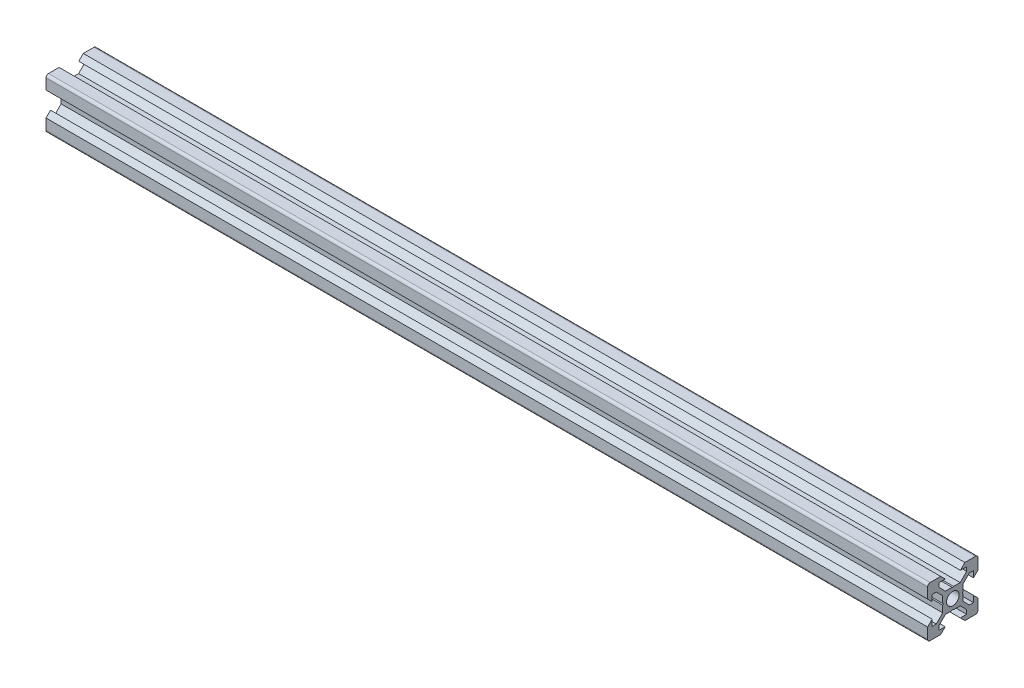
from build123d import *

# Parameters (mm, degrees)
SKETCH11_R                                    = 2.5
C_USERS_USER_GOOGLE_DRIVE_13_INFORMA_ES_DEPTH = 350


with BuildPart() as part:
    # Sketch11 → C_USERS_USER_GOOGLE DRIVE_13. INFORMA_ES (new body)
    with BuildSketch(Plane.YZ):
        with BuildLine():
            Line((-4.8, 10), (-3, 8.2))
            Line((-3, 8.2), (-5.5, 8.2))
            Line((-5.5, 8.2), (-5.5, 6.560660172))
            Line((-5.5, 6.560660172), (-2.939339828, 4))
            Line((-2.939339828, 4), (-0.3, 4))
            Line((-0.3, 4), (0, 3.7))
            Line((0, 3.7), (0.3, 4))
            Line((0.3, 4), (2.939339828, 4))
            Line((2.939339828, 4), (5.5, 6.560660172))
            Line((5.5, 6.560660172), (5.5, 8.2))
            Line((5.5, 8.2), (3, 8.2))
            Line((3, 8.2), (4.8, 10))
            Line((4.8, 10), (9, 10))
            ThreePointArc((9, 10), (9.707106781, 9.707106781), (10, 9))
            Line((10, 9), (10, 4.8))
            Line((10, 4.8), (8.2, 3))
            Line((8.2, 3), (8.2, 5.5))
            Line((8.2, 5.5), (6.560660172, 5.5))
            Line((6.560660172, 5.5), (4, 2.939339828))
            Line((4, 2.939339828), (4, 0.3))
            Line((4, 0.3), (3.7, 0))
            Line((3.7, 0), (4, -0.3))
            Line((4, -0.3), (4, -2.939339828))
            Line((4, -2.939339828), (6.560660172, -5.5))
            Line((6.560660172, -5.5), (8.2, -5.5))
            Line((8.2, -5.5), (8.2, -3))
            Line((8.2, -3), (10, -4.8))
            Line((10, -4.8), (10, -9))
            ThreePointArc((10, -9), (9.707106781, -9.707106781), (9, -10))
            Line((9, -10), (4.8, -10))
            Line((4.8, -10), (3, -8.2))
            Line((3, -8.2), (5.5, -8.2))
            Line((5.5, -8.2), (5.5, -6.560660172))
            Line((5.5, -6.560660172), (2.939339828, -4))
            Line((2.939339828, -4), (0.3, -4))
            Line((0.3, -4), (0, -3.7))
            Line((0, -3.7), (-0.3, -4))
            Line((-0.3, -4), (-2.939339828, -4))
            Line((-2.939339828, -4), (-5.5, -6.560660172))
            Line((-5.5, -6.560660172), (-5.5, -8.2))
            Line((-5.5, -8.2), (-3, -8.2))
            Line((-3, -8.2), (-4.8, -10))
            Line((-4.8, -10), (-9, -10))
            ThreePointArc((-9, -10), (-9.707106781, -9.707106781), (-10, -9))
            Line((-10, -9), (-10, -4.8))
            Line((-10, -4.8), (-8.2, -3))
            Line((-8.2, -3), (-8.2, -5.5))
            Line((-8.2, -5.5), (-6.560660172, -5.5))
            Line((-6.560660172, -5.5), (-4, -2.939339828))
            Line((-4, -2.939339828), (-4, -0.3))
            Line((-4, -0.3), (-3.7, 0))
            Line((-3.7, 0), (-4, 0.3))
            Line((-4, 0.3), (-4, 2.939339828))
            Line((-4, 2.939339828), (-6.560660172, 5.5))
            Line((-6.560660172, 5.5), (-8.2, 5.5))
            Line((-8.2, 5.5), (-8.2, 3))
            Line((-8.2, 3), (-10, 4.8))
            Line((-10, 4.8), (-10, 9))
            ThreePointArc((-10, 9), (-9.707106781, 9.707106781), (-9, 10))
            Line((-9, 10), (-4.8, 10))
        make_face()
        Circle(SKETCH11_R, mode=Mode.SUBTRACT)
    extrude(amount=C_USERS_USER_GOOGLE_DRIVE_13_INFORMA_ES_DEPTH)


solid = part.part
